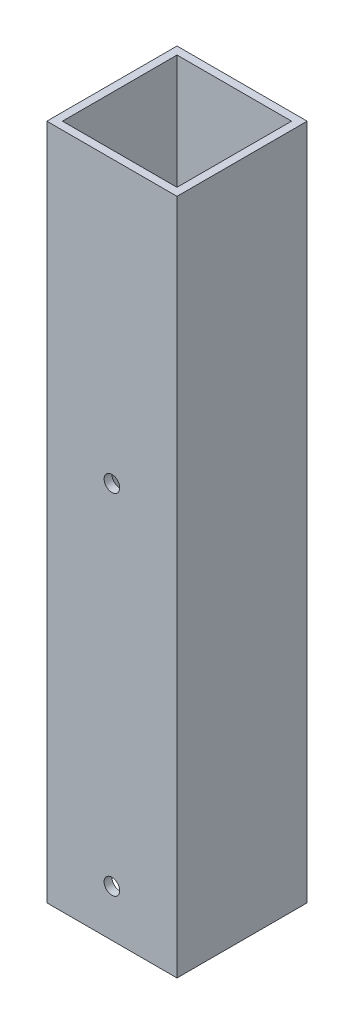
from build123d import *

# Parameters (mm, degrees)
BOSS_EXTRUDE1_DEPTH      = 65
BOSS_EXTRUDE1_DEPTH_BACK = 65
SKETCH3_W                = 25
SKETCH3_H                = 25
SKETCH3_W_2              = 22
SKETCH3_H_2              = 22
SKETCH5_R                = 1.5
CUT_EXTRUDE2_DEPTH       = 25


with BuildPart() as part:
    # Sketch3 → Boss-Extrude1 (new, two sides: drawn at the far end of the back side and taken through both)
    with BuildSketch(Plane(origin=(0, 0, 0), x_dir=(1, 0, 0), z_dir=(0, 1, 0)).offset(-BOSS_EXTRUDE1_DEPTH_BACK)):
        Rectangle(SKETCH3_W, SKETCH3_H)
        Rectangle(SKETCH3_W_2, SKETCH3_H_2, mode=Mode.SUBTRACT)
    extrude(amount=BOSS_EXTRUDE1_DEPTH + BOSS_EXTRUDE1_DEPTH_BACK)

    # Sketch5 → Cut-Extrude2 (cut)
    with BuildSketch(Plane(origin=(0, 0, -12.5), x_dir=(-1, 0, 0), z_dir=(0, 0, -1))):
        with Locations((0, -56)):
            Circle(SKETCH5_R)
        with Locations((0, 11)):
            Circle(SKETCH5_R)
    extrude(amount=-CUT_EXTRUDE2_DEPTH, mode=Mode.SUBTRACT)


solid = part.part
